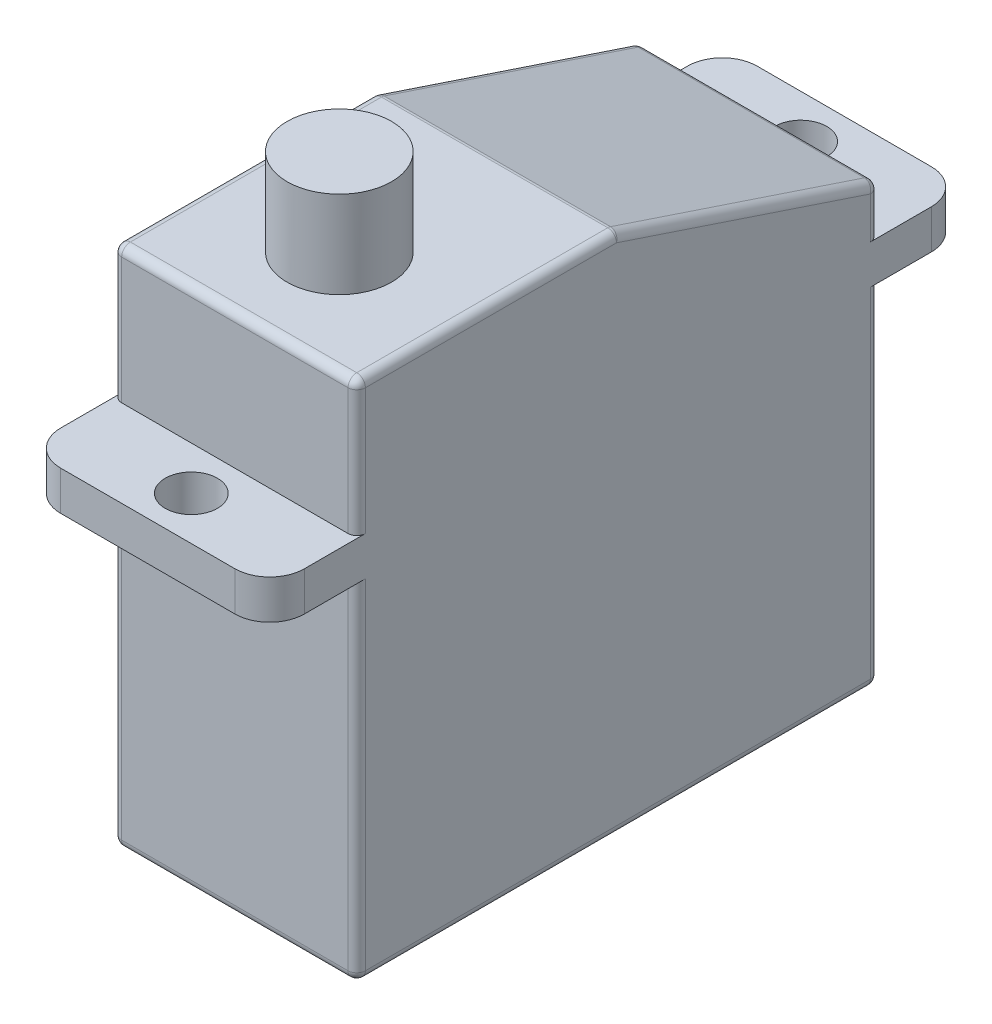
from build123d import *

# Parameters (mm, degrees)
SKETCH1_W           = 14
SKETCH1_H           = 30
BOSS_EXTRUDE1_DEPTH = 30
SKETCH2_W           = 14
SKETCH2_H           = 2.25
BOSS_EXTRUDE2_DEPTH = 5
SKETCH3_R           = 1.5
CUT_EXTRUDE1_DEPTH  = 31.725600076
SKETCH4_R           = 3
BOSS_EXTRUDE3_DEPTH = 5
CHAMFER1_SIZE       = 5
CHAMFER1_SIZE2      = 15
FILLET1_R           = 2
FILLET2_R           = 0.5


with BuildPart() as part:
    # Sketch1 → Boss-Extrude1 (new body)
    with BuildSketch(Plane(origin=(0, 0, 0), x_dir=(1, 0, 0), z_dir=(0, 1, 0))):
        Rectangle(SKETCH1_W, SKETCH1_H)
    extrude(amount=BOSS_EXTRUDE1_DEPTH)

    # Sketch2 → Boss-Extrude2 (add)
    with BuildSketch(Plane.XY.offset(15)):
        with Locations((0, 21.125)):
            Rectangle(SKETCH2_W, SKETCH2_H)
    boss_extrude2 = extrude(amount=BOSS_EXTRUDE2_DEPTH)

    # Sketch3 → Cut-Extrude1 (cut, through all)
    with BuildSketch(Plane(origin=(0, 22.25, 0), x_dir=(1, 0, 0), z_dir=(0, 1, 0))):
        with Locations(Location((0, -17.5, 0), (0, 0, 270))):
            Circle(SKETCH3_R)
    cut_extrude1 = extrude(amount=-CUT_EXTRUDE1_DEPTH, mode=Mode.SUBTRACT)

    # Mirror1: Boss-Extrude2, Cut-Extrude1 across plane
    add(boss_extrude2.mirror(Plane.XY))
    add(cut_extrude1.mirror(Plane.XY), mode=Mode.SUBTRACT)

    # Sketch4 → Boss-Extrude3 (add)
    with BuildSketch(Plane(origin=(0, 30, 0), x_dir=(1, 0, 0), z_dir=(0, 1, 0))):
        with Locations(Location((0, -9, 0), (0, 0, 90))):
            Circle(SKETCH4_R)
    extrude(amount=BOSS_EXTRUDE3_DEPTH)

    # Chamfer1
    chamfer1_edges = [part.edges().sort_by_distance(p)[0] for p in [
        (0, 30, -15),
    ]]
    chamfer1_side = [part.faces().sort_by_distance(p)[0] for p in [
        (0, 26.125, -15),
    ]]
    chamfer(chamfer1_edges, length=CHAMFER1_SIZE, length2=CHAMFER1_SIZE2, reference=chamfer1_side[0])

    # Fillet1
    fillet1_edges = [part.edges().sort_by_distance(p)[0] for p in [
        (-7, 21.125, 20),
        (7, 21.125, 20),
        (-7, 21.125, -20),
        (7, 21.125, -20),
    ]]
    fillet(fillet1_edges, radius=FILLET1_R)

    # Fillet2
    fillet2_edges = [part.edges().sort_by_distance(p)[0] for p in [
        (0, 30, 15),
        (7, 10, 15),
        (-7, 10, 15),
        (-7, 10, -15),
        (7, 10, -15),
        (7, 30, 7.5),
        (0, 0, 15),
        (-7, 0, 0),
        (0, 0, -15),
        (7, 0, 0),
        (-7, 30, 7.5),
        (0, 30, 0),
        (-7, 23.625, -15),
        (-7, 27.5, -7.5),
        (7, 23.625, -15),
        (0, 25, -15),
        (7, 27.5, -7.5),
        (7, 26.125, 15),
        (-7, 26.125, 15),
    ]]
    fillet(fillet2_edges, radius=FILLET2_R)


solid = part.part
